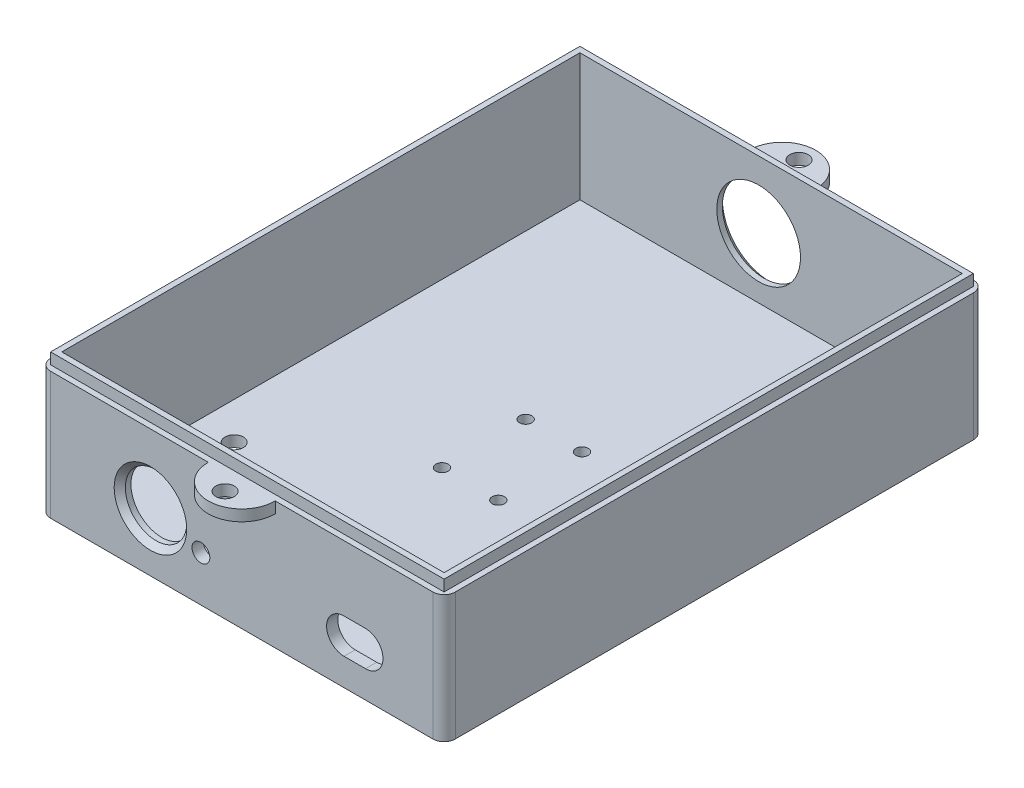
from build123d import *

# Parameters (mm, degrees)
BOSS_EXTRUDE1_DEPTH      = 18
BOSS_EXTRUDE1_DEPTH_BACK = 12.815459
SKETCH1_W                = 72.5
SKETCH1_H                = 96.828401578
SHELL1_T                 = 2
SKETCH2_R                = 7.5
CUT_EXTRUDE1_DEPTH       = 2
CHAMFER1_SIZE            = 1
SKETCH5_R                = 5.5
CUT_EXTRUDE2_DEPTH       = 2
CHAMFER2_SIZE            = 1
SKETCH8_W                = 72.5
SKETCH8_H                = 96.828401578
CUT_EXTRUDE5_DEPTH       = 8
BOSS_EXTRUDE3_START      = 10
SKETCH10_W               = 70.5
SKETCH10_H               = 94.828401578
SKETCH10_W_2             = 68.5
SKETCH10_H_2             = 92.828401578
BOSS_EXTRUDE3_DEPTH      = 2
CUT_EXTRUDE6_REACH       = 183.831
SKETCH12_R               = 1.6
FILLET1_R                = 2
BOSS_EXTRUDE4_START      = 10
SKETCH13_R               = 1.65
BOSS_EXTRUDE4_DEPTH      = 2
SKETCH16_R               = 1.65
BOSS_EXTRUDE5_DEPTH      = 2
SKETCH17_R               = 1.65
CUT_EXTRUDE8_DEPTH       = 12.81545914
SKETCH20_R               = 1.1
CUT_EXTRUDE9_DEPTH       = 2
CUT_EXTRUDE10_REACH      = 187.096
CUT_EXTRUDE11_REACH      = 187.096


with BuildPart() as part:
    # Sketch1 → Boss-Extrude1 (new, two sides: drawn at the far end of the back side and taken through both)
    with BuildSketch(Plane(origin=(0, 0, 0), x_dir=(1, 0, 0), z_dir=(0, 1, 0)).offset(-BOSS_EXTRUDE1_DEPTH_BACK)):
        with Locations((117.12025684, -15.018542133)):
            Rectangle(SKETCH1_W, SKETCH1_H)
    extrude(amount=BOSS_EXTRUDE1_DEPTH + BOSS_EXTRUDE1_DEPTH_BACK)

    # Shell1 (no face opened: a closed hollow body)
    add(offset(amount=-SHELL1_T, mode=Mode.PRIVATE), mode=Mode.SUBTRACT)

    # Sketch2 → Cut-Extrude1 (cut)
    with BuildSketch(Plane(origin=(0, 0, -33.395658656), x_dir=(-1, 0, 0), z_dir=(0, 0, -1))):
        with Locations((-114.89374317, -0.00045914)):
            Circle(SKETCH2_R)
    extrude(amount=-CUT_EXTRUDE1_DEPTH, mode=Mode.SUBTRACT)

    # Chamfer1
    chamfer1_edges = [part.edges().sort_by_distance(p)[0] for p in [
        (122.39374317, -0.00045914, -33.395658656),
    ]]
    chamfer(chamfer1_edges, length=CHAMFER1_SIZE)

    # Sketch5 → Cut-Extrude2 (cut)
    with BuildSketch(Plane.XY.offset(63.432742922)):
        with Locations((100.762134065, -2.34045914)):
            Circle(SKETCH5_R)
    extrude(amount=-CUT_EXTRUDE2_DEPTH, mode=Mode.SUBTRACT)

    # Chamfer2
    chamfer2_edges = [part.edges().sort_by_distance(p)[0] for p in [
        (95.262134065, -2.34045914, 63.432742922),
    ]]
    chamfer(chamfer2_edges, length=CHAMFER2_SIZE)

    # Sketch8 → Cut-Extrude5 (cut)
    with BuildSketch(Plane(origin=(0, 18, 0), x_dir=(1, 0, 0), z_dir=(0, 1, 0))):
        with Locations((117.12025684, -15.018542133)):
            Rectangle(SKETCH8_W, SKETCH8_H)
    extrude(amount=-CUT_EXTRUDE5_DEPTH, mode=Mode.SUBTRACT)

    # Sketch10 → Boss-Extrude3 (add)
    with BuildSketch(Plane(origin=(0, 0, 0), x_dir=(1, 0, 0), z_dir=(0, 1, 0)).offset(BOSS_EXTRUDE3_START)):
        with Locations((117.12025684, -15.018542133)):
            Rectangle(SKETCH10_W, SKETCH10_H)
        with Locations((117.12025684, -15.018542133)):
            Rectangle(SKETCH10_W_2, SKETCH10_H_2, mode=Mode.SUBTRACT)
    extrude(amount=BOSS_EXTRUDE3_DEPTH)

    # Sketch12 → Cut-Extrude6 (cut, up to next)
    with BuildSketch(Plane.XY.offset(63.432742922), mode=Mode.PRIVATE) as cut_extrude6_sk1:
        with Locations((109.796270245, -4.680244976)):
            Circle(SKETCH12_R)
    cut_extrude6_tool1 = extrude(cut_extrude6_sk1.sketch, amount=-CUT_EXTRUDE6_REACH, mode=Mode.PRIVATE) & part.part
    add(cut_extrude6_tool1.solids().sort_by_distance((109.79627, -4.680245, 63.432743))[0], mode=Mode.SUBTRACT)

    # Fillet1
    fillet1_edges = [part.edges().sort_by_distance(p)[0] for p in [
        (80.87025684, -1.4077295, -33.395658656),
        (153.37025684, -1.4077295, -33.395658656),
        (153.37025684, -1.4077295, 63.432742922),
        (80.87025684, -1.4077295, 63.432742922),
    ]]
    fillet(fillet1_edges, radius=FILLET1_R)

    # Sketch13 → Boss-Extrude4 (add)
    with BuildSketch(Plane(origin=(0, 0, 0), x_dir=(1, 0, 0), z_dir=(0, 1, 0)).offset(BOSS_EXTRUDE4_START)):
        with BuildLine():
            Line((111.12025684, -63.432742922), (123.12025684, -63.432742922))
            ThreePointArc((123.12025684, -63.432742922), (117.12025684, -69.432742922), (111.12025684, -63.432742922))
        make_face()
        with Locations(Location((117.12025684, -66.432742922, 0), (0, 0, 270))):
            Circle(SKETCH13_R, mode=Mode.SUBTRACT)
    boss_extrude4 = extrude(amount=-BOSS_EXTRUDE4_DEPTH)

    # Sketch16 → Boss-Extrude5 (add)
    with BuildSketch(Plane(origin=(0, 10, 0), x_dir=(1, 0, 0), z_dir=(0, 1, 0))):
        with BuildLine():
            Line((111.12025684, 33.395658656), (123.12025684, 33.395658656))
            ThreePointArc((123.12025684, 33.395658656), (117.12025684, 39.395658656), (111.12025684, 33.395658656))
        make_face()
        with Locations(Location((117.12025684, 36.395658656, 0), (0, 0, 270))):
            Circle(SKETCH16_R, mode=Mode.SUBTRACT)
    extrude(amount=-BOSS_EXTRUDE5_DEPTH)

    # Sketch17 → Cut-Extrude8 (cut)
    with BuildSketch(Plane(origin=(0, 0, 0), x_dir=(1, 0, 0), z_dir=(0, 1, 0))):
        with Locations(Location((137.785174065, -38.462742922, 0), (0, 0, 90))):
            Circle(SKETCH17_R)
        with Locations(Location((89.525174065, -37.192742922, 0), (0, 0, 90))):
            Circle(SKETCH17_R)
    extrude(amount=-CUT_EXTRUDE8_DEPTH, mode=Mode.SUBTRACT)

    # Mirror1: Boss-Extrude4 across plane
    add(boss_extrude4.mirror(Plane.XY.offset(15.018542133)))

    # Sketch20 → Cut-Extrude9 (cut)
    with BuildSketch(Plane.XZ.offset(12.81545914)):
        with Locations(Location((112.07025684, 22.518542133, 0), (0, 0, 270))):
            Circle(SKETCH20_R)
        with Locations(Location((122.17025684, 22.518542133, 0), (0, 0, 270))):
            Circle(SKETCH20_R)
        with Locations(Location((122.17025684, 7.518542133, 0), (0, 0, 270))):
            Circle(SKETCH20_R)
        with Locations(Location((112.07025684, 7.518542133, 0), (0, 0, 270))):
            Circle(SKETCH20_R)
    extrude(amount=-CUT_EXTRUDE9_DEPTH, mode=Mode.SUBTRACT)

    # Sketch21 → Cut-Extrude10 (cut, up to next)
    with BuildSketch(Plane.XY.offset(63.432742922), mode=Mode.PRIVATE) as cut_extrude10_sk1:
        with BuildLine():
            Line((139.29525684, -7.94045914), (135.44525684, -7.94045914))
            ThreePointArc((135.44525684, -7.94045914), (132.32025684, -4.81545914), (135.44525684, -1.69045914))
            Line((135.44525684, -1.69045914), (139.29525684, -1.69045914))
            ThreePointArc((139.29525684, -1.69045914), (142.42025684, -4.81545914), (139.29525684, -7.94045914))
        make_face()
    cut_extrude10_tool1 = extrude(cut_extrude10_sk1.sketch, amount=-CUT_EXTRUDE10_REACH, mode=Mode.PRIVATE) & part.part
    add(cut_extrude10_tool1.solids().sort_by_distance((137.370257, -4.815459, 63.432743))[0], mode=Mode.SUBTRACT)

    # Sketch23 → Cut-Extrude11 (cut, up to next)
    with BuildSketch(Plane(origin=(0, 0, -33.395658656), x_dir=(1, 0, 0), z_dir=(0, 0, -1)), mode=Mode.PRIVATE) as cut_extrude11_sk1:
        with BuildLine():
            Line((141.24525684, 3.69045914), (137.49525684, 3.69045914))
            ThreePointArc((137.49525684, 3.69045914), (134.37025684, 6.81545914), (137.49525684, 9.94045914))
            Line((137.49525684, 9.94045914), (141.24525684, 9.94045914))
            ThreePointArc((141.24525684, 9.94045914), (144.37025684, 6.81545914), (141.24525684, 3.69045914))
        make_face()
    cut_extrude11_tool1 = extrude(cut_extrude11_sk1.sketch, amount=-CUT_EXTRUDE11_REACH, mode=Mode.PRIVATE) & part.part
    add(cut_extrude11_tool1.solids().sort_by_distance((139.370257, -6.815459, -33.395659))[0], mode=Mode.SUBTRACT)


solid = part.part
